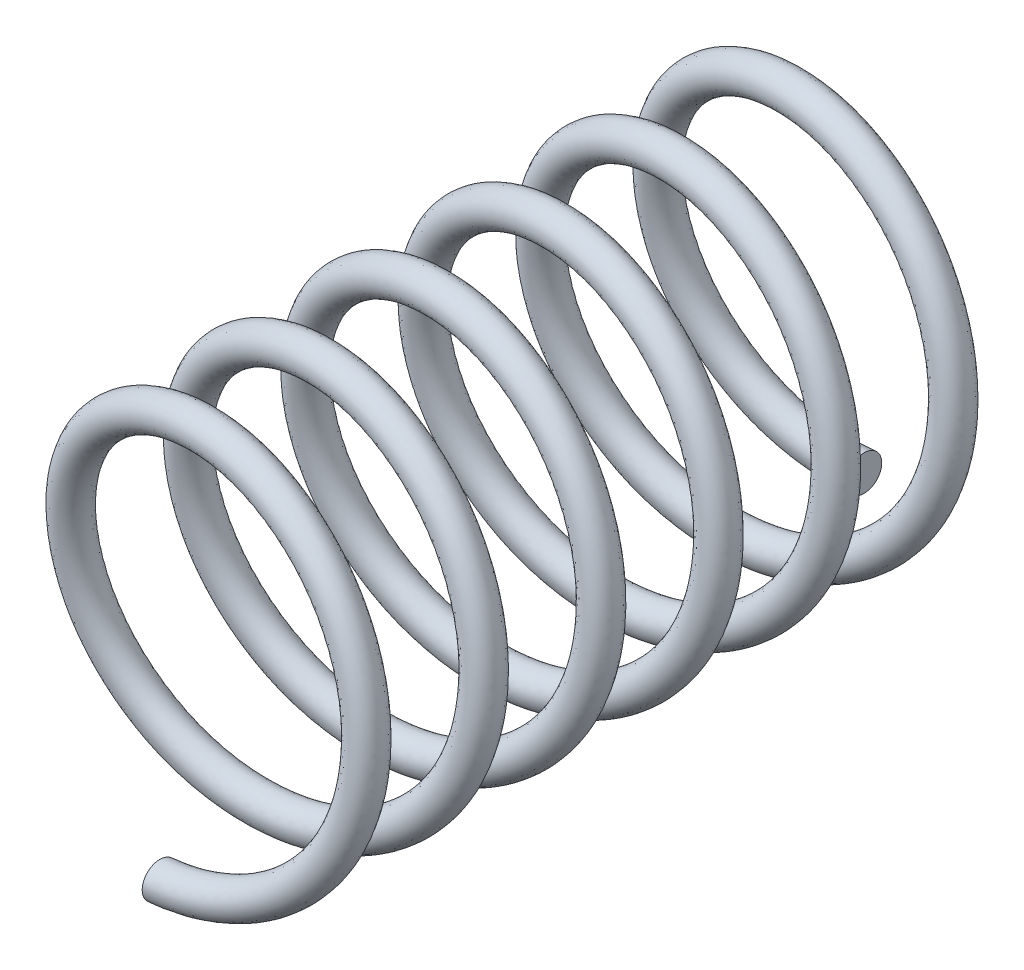
from build123d import *

# Parameters (mm, degrees)
SWEEP1_PITCH       = 2
SWEEP1_HEIGHT      = 12
SWEEP1_RADIUS      = 3
SWEEP1_START_ANGLE = -90
SKETCH4_R          = 0.3


with BuildPart() as part:
    # Sweep1: sweep along a helix
    with BuildLine() as sweep1_path:
        add(Helix(SWEEP1_PITCH, SWEEP1_HEIGHT, SWEEP1_RADIUS, center=(0, 0, 0), direction=(0, 0, 1), lefthand=True, mode=Mode.PRIVATE).rotate(Axis((0, 0, 0), (0, 0, 1)), SWEEP1_START_ANGLE))
    # Sketch4 → Sweep1 (sweep)
    with BuildSketch(Plane(origin=(0, 0, 0), x_dir=(0, 0, -1), z_dir=(1, 0, 0))):
        with Locations((0, -3)):
            Circle(SKETCH4_R)
    sweep(path=sweep1_path.line, is_frenet=True)


solid = part.part
